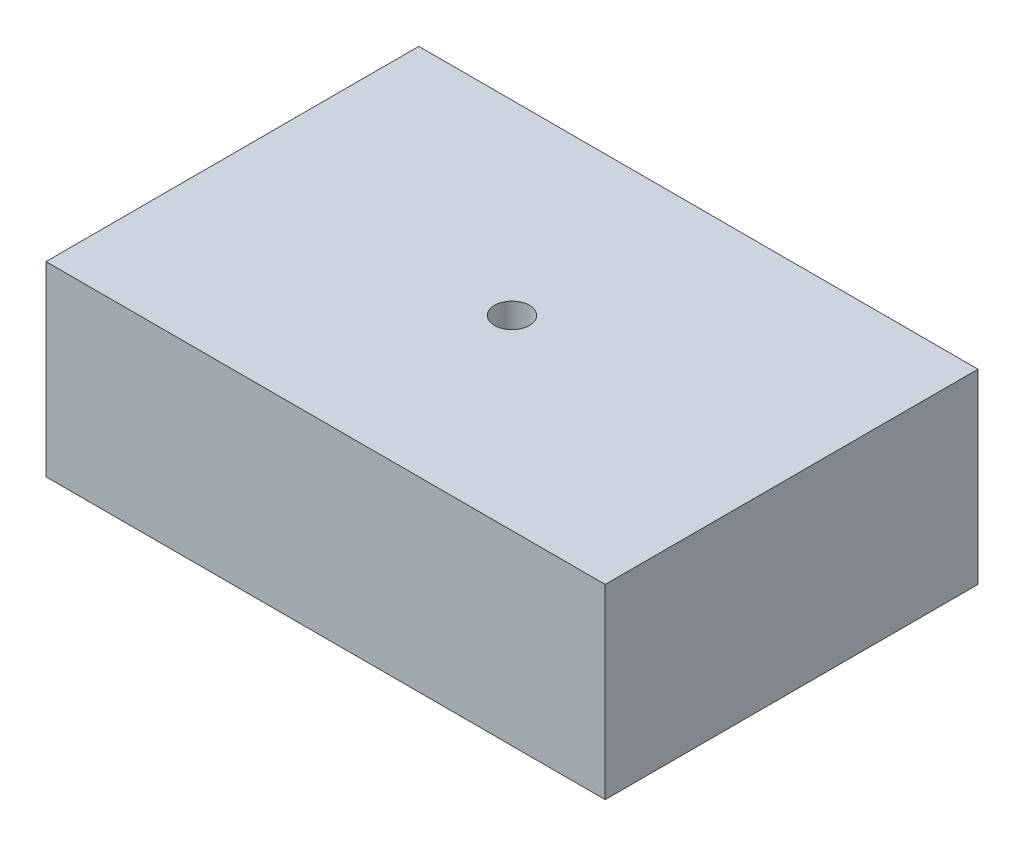
from build123d import *

# Parameters (mm, degrees)
SKETCH1_W           = 76.2
SKETCH1_H           = 50.8
SKETCH1_R           = 2.38125
BOSS_EXTRUDE1_DEPTH = 25.4


with BuildPart() as part:
    # Sketch1 → Boss-Extrude1 (new body)
    with BuildSketch(Plane(origin=(0, 0, 0), x_dir=(1, 0, 0), z_dir=(0, 1, 0))):
        with Locations((38.1, -25.4)):
            Rectangle(SKETCH1_W, SKETCH1_H)
        with Locations(Location((38.1, -25.4, 0), (0, 0, 270))):
            Circle(SKETCH1_R, mode=Mode.SUBTRACT)
    extrude(amount=BOSS_EXTRUDE1_DEPTH)


solid = part.part
